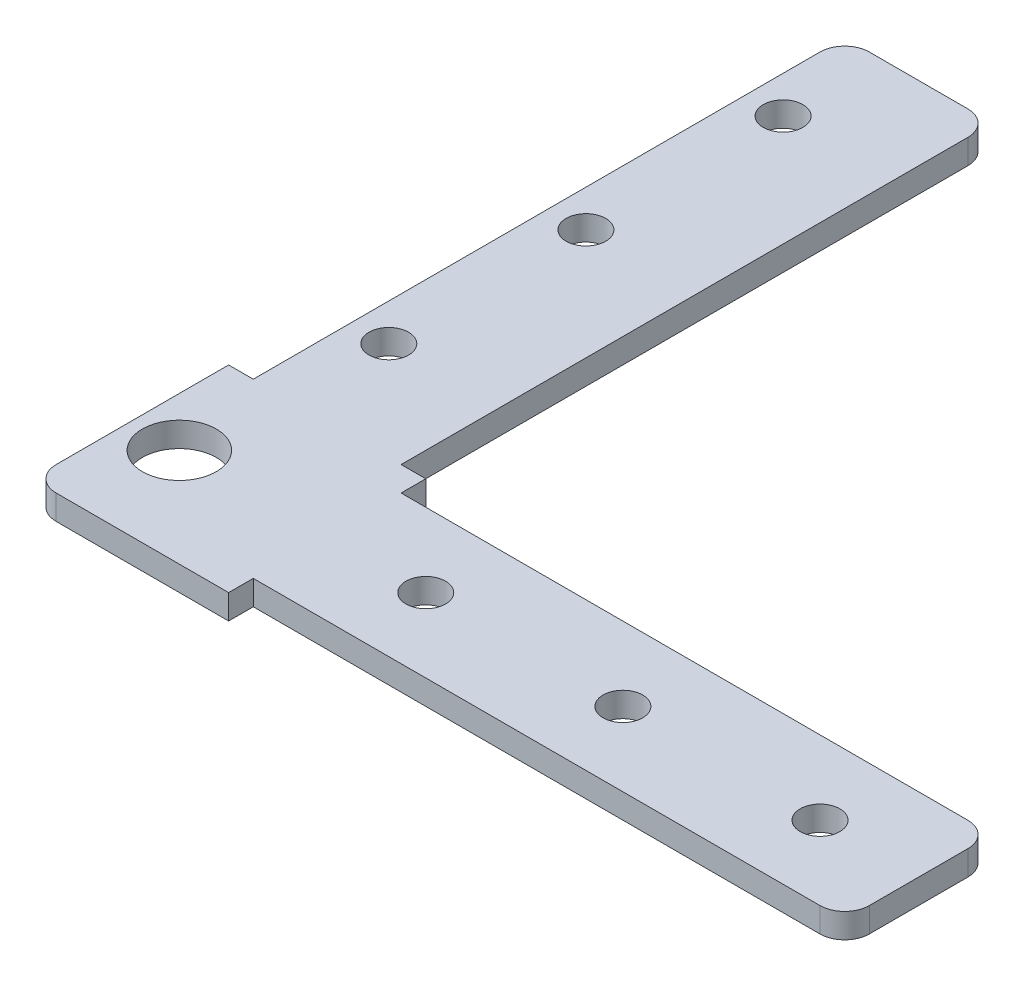
from build123d import *

# Parameters (mm, degrees)
BOSS_EXTRUDE1_DEPTH    = 3.175
F_10_CLEARANCE_HOLE1_D = 5.1054
SKETCH5_R              = 4.7625
CUT_EXTRUDE1_DEPTH     = 144.719172782
FILLET1_R              = 3.175


with BuildPart() as part:
    # Sketch2 → Boss-Extrude1 (new body)
    with BuildSketch(Plane(origin=(0, 0, 0), x_dir=(1, 0, 0), z_dir=(0, 1, 0))):
        Polygon((0, 0), (0, 25.4), (3.175, 25.4), (3.175, 101.6), (22.225, 101.6), (22.225, 25.4), (25.4, 25.4), (25.4, 22.225), (101.6, 22.225), (101.6, 3.175), (25.4, 3.175), (25.4, 0), align=None)
    extrude(amount=BOSS_EXTRUDE1_DEPTH)

    # #10 Clearance Hole1 (through all)
    with Locations(Plane(origin=(0, 3.175, 0), x_dir=(1, 0, 0), z_dir=(0, 1, 0))):
        with Locations((88.9, 12.7), (7.9375, 88.9), (7.9375, 63.5), (7.9375, 38.1), (38.1, 12.7), (63.5, 12.7)):
            Hole(F_10_CLEARANCE_HOLE1_D / 2)

    # Sketch5 → Cut-Extrude1 (cut, through all)
    with BuildSketch(Plane(origin=(0, 3.175, 0), x_dir=(1, 0, 0), z_dir=(0, 1, 0))):
        with Locations(Location((6.35, 12.7, 0), (0, 0, 270))):
            Circle(SKETCH5_R)
    extrude(amount=-CUT_EXTRUDE1_DEPTH, mode=Mode.SUBTRACT)

    # Fillet1
    fillet1_edges = [part.edges().sort_by_distance(p)[0] for p in [
        (0, 1.5875, 0),
        (3.175, 1.5875, -101.6),
        (22.225, 1.5875, -101.6),
        (101.6, 1.5875, -22.225),
        (101.6, 1.5875, -3.175),
    ]]
    fillet(fillet1_edges, radius=FILLET1_R)


solid = part.part
